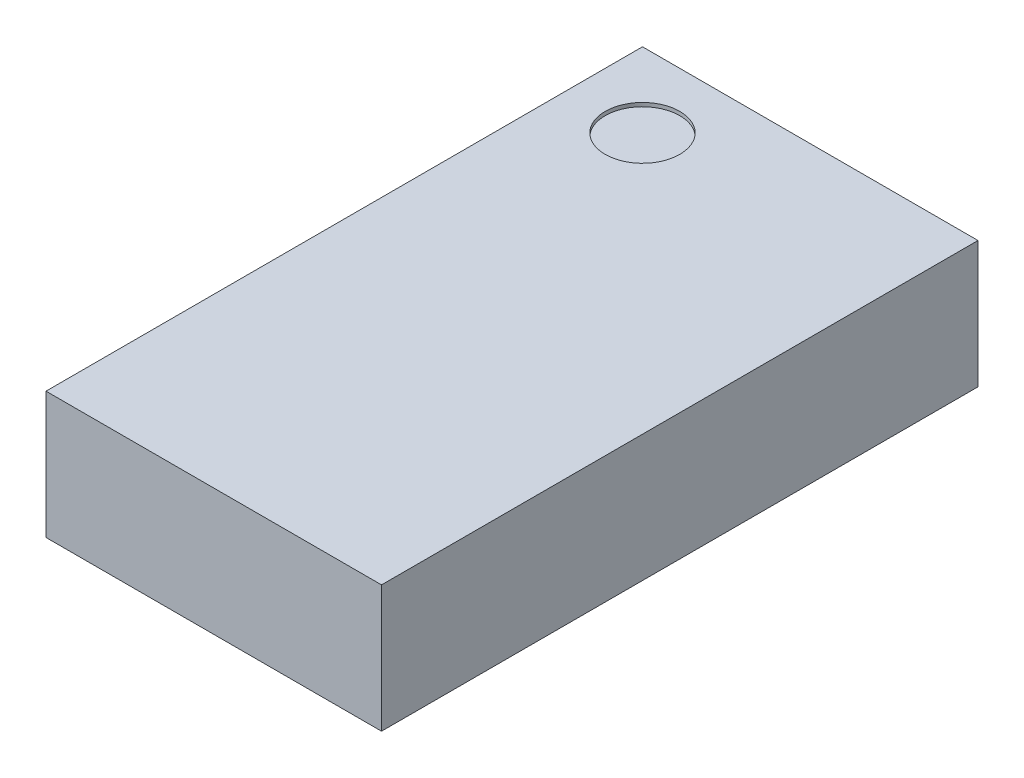
from build123d import *

# Parameters (mm, degrees)
SKETCH1_W           = 0.9
SKETCH1_H           = 1.6
BOSS_EXTRUDE1_DEPTH = 0.34
SKETCH3_R           = 0.1
CUT_EXTRUDE1_DEPTH  = 0.01
LPATTERN1_COUNT     = 2
LPATTERN1_PITCH     = 0.4
LPATTERN1_COL_COUNT = 2
LPATTERN1_COL_PITCH = 0.4


with BuildPart() as part:
    # Sketch1 → Boss-Extrude1 (new body)
    with BuildSketch(Plane(origin=(0, 0.16, 0), x_dir=(1, 0, 0), z_dir=(0, 1, 0))):
        Rectangle(SKETCH1_W, SKETCH1_H)
    extrude(amount=BOSS_EXTRUDE1_DEPTH)

    # Sketch3 → Cut-Extrude1 (cut)
    with BuildSketch(Plane(origin=(0, 0.5, 0), x_dir=(1, 0, 0), z_dir=(0, 1, 0))):
        with Locations(Location((-0.25, 0.6, 0), (0, 0, 270))):
            Circle(SKETCH3_R)
    extrude(amount=-CUT_EXTRUDE1_DEPTH, mode=Mode.SUBTRACT)

    # Sketch2 → Revolve3 (revolve)
    with BuildSketch(Plane.XY):
        with BuildLine():
            Line((-0.2, 0.23), (-0.2, 0))
            ThreePointArc((-0.2, 0), (-0.315, 0.115), (-0.2, 0.23))
        make_face()
    revolve3 = revolve(axis=Axis((-0.2, 0.23, 0), (0, -1, 0)))

    # LPattern1: Revolve3 ×2
    with Locations(*[(0, 0, -i * LPATTERN1_PITCH) for i in range(1, LPATTERN1_COUNT)]):
        add(revolve3)

    # LPattern1 col: Revolve3 ×2
    with Locations(*[(0, 0, i * LPATTERN1_COL_PITCH) for i in range(1, LPATTERN1_COL_COUNT)]):
        add(revolve3)

    # Mirror1: Revolve3 across plane
    add(revolve3.mirror(Plane(origin=(0, 0, 0), x_dir=(0, 0, 1), z_dir=(1, 0, 0))))

    # Mirror1 copy 1 sketch → Mirror1 copy 1 (revolve)
    with BuildSketch(Plane(origin=(0, 0, -0.4), x_dir=(-1, 0, 0), z_dir=(0, 0, 1))):
        with BuildLine():
            Line((-0.2, -0.23), (-0.2, 0))
            ThreePointArc((-0.2, 0), (-0.315, -0.115), (-0.2, -0.23))
        make_face()
    revolve(axis=Axis((0.2, 0.23, -0.4), (0, 1, 0)))

    # Mirror1 copy 2 sketch → Mirror1 copy 2 (revolve)
    with BuildSketch(Plane(origin=(0, 0, 0.4), x_dir=(-1, 0, 0), z_dir=(0, 0, 1))):
        with BuildLine():
            Line((-0.2, -0.23), (-0.2, 0))
            ThreePointArc((-0.2, 0), (-0.315, -0.115), (-0.2, -0.23))
        make_face()
    revolve(axis=Axis((0.2, 0.23, 0.4), (0, 1, 0)))


solid = part.part
